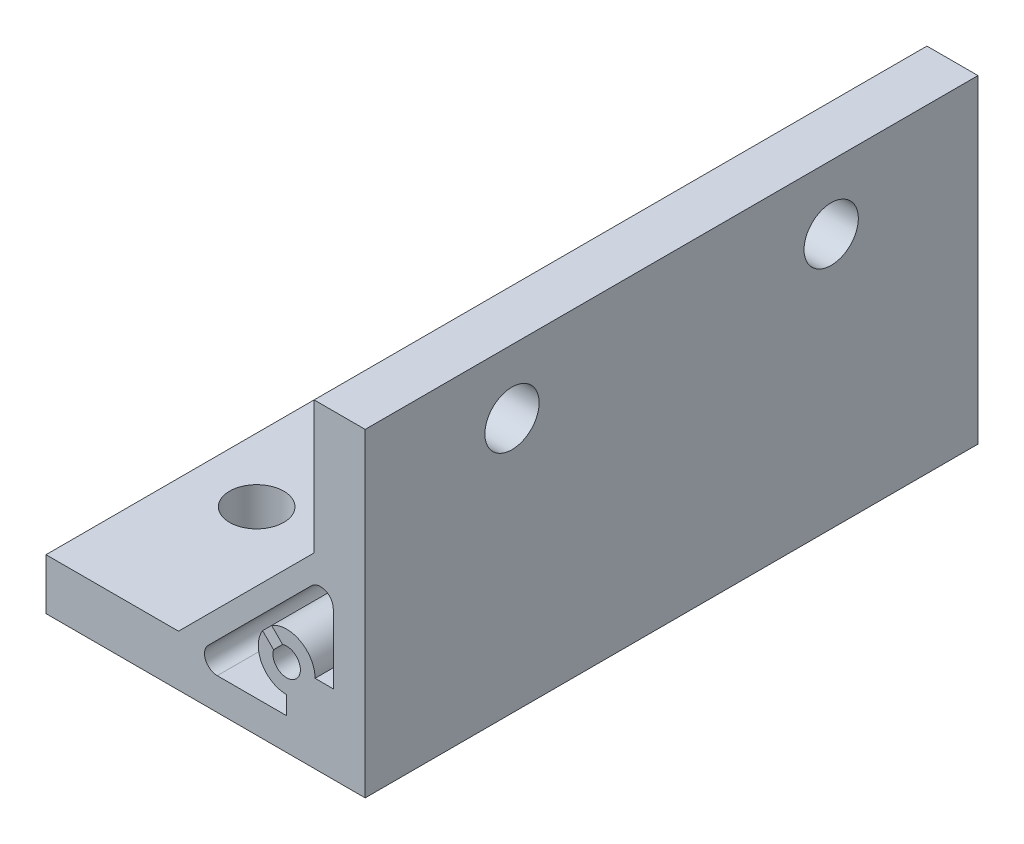
from build123d import *

# Parameters (mm, degrees)
EXTRUDE_1_DEPTH     = 48
SKETCH_3_R          = 4.25
CUT_EXTRUDE_1_DEPTH = 82.043198357


with BuildPart() as part:
    # 草图1 → 凸台-拉伸1 (new, symmetric)
    with BuildSketch(Plane.XY):
        Polygon((0, 0), (50, 0), (50, 50), (42, 50), (42, 29.242640687), (20.757359313, 8), (0, 8), align=None)
        with BuildLine():
            Line((37.061279898, 14.352933665), (35.340960992, 16.07325257))
            ThreePointArc((35.340960992, 16.07325257), (39.856939547, 16.192314452), (42.15, 12.3))
            Line((42.15, 12.3), (45, 12.3))
            Line((45, 12.3), (45, 23.171572875))
            ThreePointArc((45, 23.171572875), (43.765366865, 25.01933194), (41.585786438, 24.585786438))
            Line((41.585786438, 24.585786438), (25.414213562, 8.414213562))
            ThreePointArc((25.414213562, 8.414213562), (24.98066806, 6.234633135), (26.828427125, 5))
            Line((26.828427125, 5), (37.7, 5))
            Line((37.7, 5), (37.7, 7.85))
            ThreePointArc((37.7, 7.85), (33.807685548, 10.143060453), (33.92674743, 14.659039008))
            Line((33.92674743, 14.659039008), (35.647066335, 12.938720102))
            ThreePointArc((35.647066335, 12.938720102), (39.22027958, 10.77972042), (37.061279898, 14.352933665))
        make_face(mode=Mode.SUBTRACT)
    extrude(amount=EXTRUDE_1_DEPTH, both=True)

    # 草图3 → 切除-拉伸1 (cut, through all)
    with BuildSketch(Plane(origin=(0, 8, 0), x_dir=(1, 0, 0), z_dir=(0, 1, 0))):
        with Locations(Location((10, 25, 0), (0, 0, 270))):
            Circle(SKETCH_3_R)
        with Locations(Location((10, -25, 0), (0, 0, 90))):
            Circle(SKETCH_3_R)
    cut_extrude_1 = extrude(amount=-CUT_EXTRUDE_1_DEPTH, mode=Mode.SUBTRACT)

    # 镜向1: 切除-拉伸1 across plane
    add(cut_extrude_1.mirror(Plane(origin=(25, 25, 0), x_dir=(0, 0, 1), z_dir=(-0.7071067811865486, -0.7071067811865465, 0))), mode=Mode.SUBTRACT)


solid = part.part
